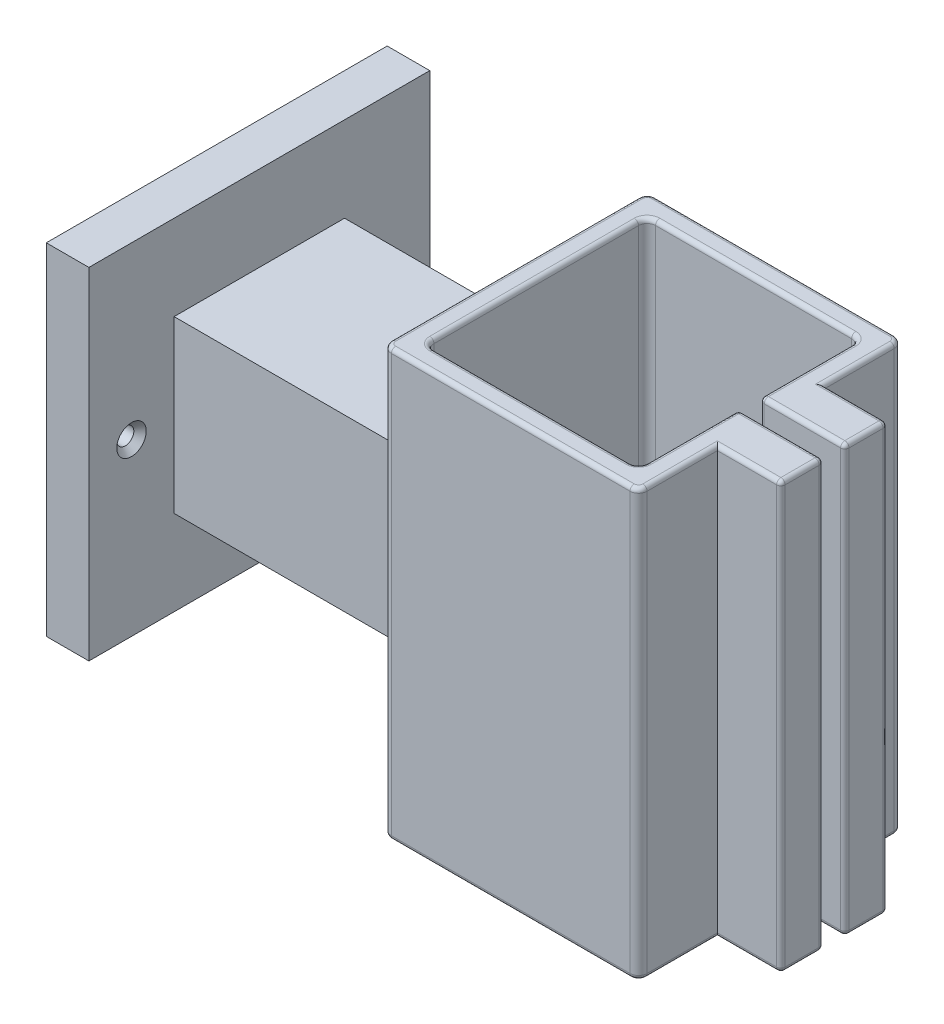
from build123d import *

# Parameters (mm, degrees)
BOSS_EXTRUDE1_DEPTH             = 50
SKETCH5_W                       = 20
SKETCH5_H                       = 20
BOSS_EXTRUDE2_DEPTH             = 30
SKETCH6_W                       = 40
SKETCH6_H                       = 40
BOSS_EXTRUDE3_DEPTH             = 5
F_2_64_TAPPED_HOLE1_D           = 2.000000064
F_2_64_TAPPED_HOLE1_DEPTH       = 5
F_2_64_TAPPED_HOLE1_CSINK_D     = 3.4544
F_2_64_TAPPED_HOLE1_CSINK_ANGLE = 90
F_2_64_TAPPED_HOLE1_TIP         = 0.600860638
FILLET2_R                       = 0.5
SKETCH12_R                      = 2.5
CUT_EXTRUDE1_DEPTH              = 1
F_4_40_TAPPED_HOLE1_D           = 2.2606
F_4_40_TAPPED_HOLE1_DEPTH       = 10.320847242
F_4_40_TAPPED_HOLE1_CSINK_D     = 4.1148
F_4_40_TAPPED_HOLE1_CSINK_ANGLE = 90
F_4_40_TAPPED_HOLE1_TIP         = 0.679152758


with BuildPart() as part:
    # Sketch1 → Boss-Extrude1 (new body)
    with BuildSketch(Plane(origin=(0, 0, 0), x_dir=(1, 0, 0), z_dir=(0, 1, 0))):
        with BuildLine():
            Line((34.952174036, 11.75), (25, 11.75))
            Line((25, 11.75), (25, 1))
            ThreePointArc((25, 1), (24.707106781, 0.292893219), (24, 0))
            Line((24, 0), (1, 0))
            ThreePointArc((1, 0), (0.292893219, 0.292893219), (0, 1))
            Line((0, 1), (0, 25))
            ThreePointArc((0, 25), (0.292893219, 25.707106781), (1, 26))
            Line((1, 26), (24, 26))
            ThreePointArc((24, 26), (24.707106781, 25.707106781), (25, 25))
            Line((25, 25), (25, 14.25))
            Line((25, 14.25), (34.952174036, 14.25))
            Line((34.952174036, 14.25), (34.952174036, 19.25))
            Line((34.952174036, 19.25), (27.5, 19.25))
            Line((27.5, 19.25), (27.5, 27.5))
            ThreePointArc((27.5, 27.5), (27.207106781, 28.207106781), (26.5, 28.5))
            Line((26.5, 28.5), (-1.5, 28.5))
            ThreePointArc((-1.5, 28.5), (-2.207106781, 28.207106781), (-2.5, 27.5))
            Line((-2.5, 27.5), (-2.5, -1.5))
            ThreePointArc((-2.5, -1.5), (-2.207106781, -2.207106781), (-1.5, -2.5))
            Line((-1.5, -2.5), (26.5, -2.5))
            ThreePointArc((26.5, -2.5), (27.207106781, -2.207106781), (27.5, -1.5))
            Line((27.5, -1.5), (27.5, 6.75))
            Line((27.5, 6.75), (34.952174036, 6.75))
            Line((34.952174036, 6.75), (34.952174036, 11.75))
        make_face()
    extrude(amount=BOSS_EXTRUDE1_DEPTH)

    # Sketch5 → Boss-Extrude2 (add)
    with BuildSketch(Plane.ZY.offset(2.5)):
        with Locations((-13, 25)):
            Rectangle(SKETCH5_W, SKETCH5_H)
    extrude(amount=BOSS_EXTRUDE2_DEPTH)

    # Sketch6 → Boss-Extrude3 (add)
    with BuildSketch(Plane.ZY.offset(32.5)):
        with Locations((-13, 25)):
            Rectangle(SKETCH6_W, SKETCH6_H)
    extrude(amount=BOSS_EXTRUDE3_DEPTH)

    # #2-64 Tapped Hole1
    with Locations(Plane(origin=(-32.5, 0, 0), x_dir=(0, 0, -1), z_dir=(1, 0, 0))):
        with Locations((-2, 25), (28, 25)):
            CounterSinkHole(F_2_64_TAPPED_HOLE1_D / 2, F_2_64_TAPPED_HOLE1_CSINK_D / 2, depth=F_2_64_TAPPED_HOLE1_DEPTH, counter_sink_angle=F_2_64_TAPPED_HOLE1_CSINK_ANGLE)
            with Locations((0, 0, -(F_2_64_TAPPED_HOLE1_DEPTH + F_2_64_TAPPED_HOLE1_TIP / 2))):  # 118° drill point
                Cone(0, F_2_64_TAPPED_HOLE1_D / 2, F_2_64_TAPPED_HOLE1_TIP, mode=Mode.SUBTRACT)

    # Fillet2
    fillet2_edges = [part.edges().sort_by_distance(p)[0] for p in [
        (-2.207106781, 50, -28.207106781),
        (29.976087018, 50, -14.25),
        (34.952174036, 50, -16.75),
        (31.226087018, 50, -19.25),
        (27.5, 50, -23.375),
        (27.207106781, 50, -28.207106781),
        (-2.5, 50, -13),
        (-2.207106781, 50, 2.207106781),
        (12.5, 50, 2.5),
        (27.207106781, 0, -28.207106781),
        (27.5, 0, -23.375),
        (31.226087018, 0, -19.25),
        (34.952174036, 0, -16.75),
        (29.976087018, 0, -14.25),
        (25, 0, -19.625),
        (24.707106781, 0, -25.707106781),
        (12.5, 0, -26),
        (27.207106781, 50, 2.207106781),
        (0.292893219, 0, -25.707106781),
        (0, 0, -13),
        (0.292893219, 0, -0.292893219),
        (12.5, 0, 0),
        (24.707106781, 0, -0.292893219),
        (25, 0, -6.375),
        (29.976087018, 0, -11.75),
        (34.952174036, 0, -9.25),
        (31.226087018, 0, -6.75),
        (27.5, 50, -2.625),
        (27.5, 0, -2.625),
        (27.207106781, 0, 2.207106781),
        (12.5, 0, 2.5),
        (-2.207106781, 0, 2.207106781),
        (-2.5, 0, -13),
        (-2.207106781, 0, -28.207106781),
        (12.5, 0, -28.5),
        (31.226087018, 50, -6.75),
        (34.952174036, 50, -9.25),
        (34.952174036, 25, -19.25),
        (34.952174036, 25, -14.25),
        (25, 25, -14.25),
        (25, 25, -11.75),
        (34.952174036, 25, -11.75),
        (34.952174036, 25, -6.75),
        (12.5, 50, -28.5),
        (29.976087018, 50, -11.75),
        (25, 50, -6.375),
        (24.707106781, 50, -0.292893219),
        (12.5, 50, 0),
        (0.292893219, 50, -0.292893219),
        (0, 50, -13),
        (0.292893219, 50, -25.707106781),
        (12.5, 50, -26),
        (24.707106781, 50, -25.707106781),
        (25, 50, -19.625),
    ]]
    fillet(fillet2_edges, radius=FILLET2_R)

    # Sketch12 → Cut-Extrude1 (cut)
    with BuildSketch(Plane(origin=(0, 0, -19.25), x_dir=(-1, 0, 0), z_dir=(0, 0, -1))):
        with Locations((-30.976087018, 40)):
            Circle(SKETCH12_R)
        with Locations((-30.976087018, 25)):
            Circle(SKETCH12_R)
        with Locations((-30.976087018, 10)):
            Circle(SKETCH12_R)
    extrude(amount=-CUT_EXTRUDE1_DEPTH, mode=Mode.SUBTRACT)

    # #4-40 Tapped Hole1
    with Locations(Plane(origin=(0, 0, -18.25), x_dir=(-1, 0, 0), z_dir=(0, 0, -1))):
        with Locations((-30.976087018, 40), (-30.976087018, 25), (-30.976087018, 10)):
            CounterSinkHole(F_4_40_TAPPED_HOLE1_D / 2, F_4_40_TAPPED_HOLE1_CSINK_D / 2, depth=F_4_40_TAPPED_HOLE1_DEPTH, counter_sink_angle=F_4_40_TAPPED_HOLE1_CSINK_ANGLE)
            with Locations((0, 0, -(F_4_40_TAPPED_HOLE1_DEPTH + F_4_40_TAPPED_HOLE1_TIP / 2))):  # 118° drill point
                Cone(0, F_4_40_TAPPED_HOLE1_D / 2, F_4_40_TAPPED_HOLE1_TIP, mode=Mode.SUBTRACT)


solid = part.part
